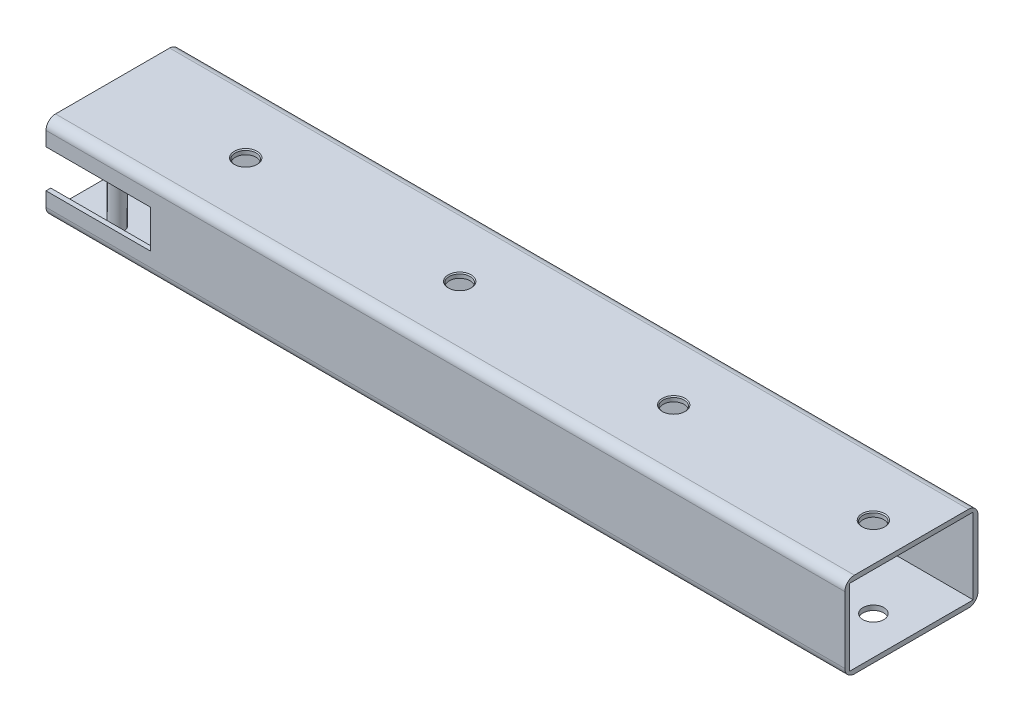
from build123d import *

# Parameters (mm, degrees)
SKETCH1_W                        = 840
SKETCH1_H                        = 140
BOSS_EXTRUDE1_DEPTH              = 90
SKETCH2_W                        = 130
SKETCH2_H                        = 80
CUT_EXTRUDE1_DEPTH               = 848.702778101
FILLET2_R                        = 10
FILLET4_R                        = 10
M24X2_0_TAPPED_HOLE1_D           = 22
M24X2_0_TAPPED_HOLE1_CSINK_D     = 24.05
M24X2_0_TAPPED_HOLE1_CSINK_ANGLE = 90
CUT_EXTRUDE2_REACH               = 453.774
SKETCH7_W                        = 127
SKETCH7_H                        = 40
BOSS_EXTRUDE2_REACH              = 436.195
SKETCH8_R                        = 7.5


with BuildPart() as part:
    # Sketch1 → Boss-Extrude1 (new body)
    with BuildSketch(Plane(origin=(0, 0, 0), x_dir=(1, 0, 0), z_dir=(0, 1, 0))):
        Rectangle(SKETCH1_W, SKETCH1_H)
    extrude(amount=BOSS_EXTRUDE1_DEPTH)

    # Sketch2 → Cut-Extrude1 (cut, through all)
    with BuildSketch(Plane(origin=(420, 0, 0), x_dir=(0, 0, -1), z_dir=(1, 0, 0))):
        with Locations((0, 45)):
            Rectangle(SKETCH2_W, SKETCH2_H)
    extrude(amount=-CUT_EXTRUDE1_DEPTH, mode=Mode.SUBTRACT)

    # Fillet2
    fillet2_edges = [part.edges().sort_by_distance(p)[0] for p in [
        (0, 0, -70),
        (0, 90, -70),
    ]]
    fillet(fillet2_edges, radius=FILLET2_R)

    # Fillet4
    fillet4_edges = [part.edges().sort_by_distance(p)[0] for p in [
        (0, 90, 70),
        (0, 0, 70),
    ]]
    fillet(fillet4_edges, radius=FILLET4_R)

    # M24x2.0 Tapped Hole1 (through all)
    with Locations(Plane(origin=(0, 90, 0), x_dir=(1, 0, 0), z_dir=(0, 1, 0))):
        with Locations((-55, 0), (170, 0), (-280, 0), (380, 0)):
            CounterSinkHole(M24X2_0_TAPPED_HOLE1_D / 2, M24X2_0_TAPPED_HOLE1_CSINK_D / 2, counter_sink_angle=M24X2_0_TAPPED_HOLE1_CSINK_ANGLE)

    # Sketch7 → Cut-Extrude2 (cut, up to next)
    with BuildSketch(Plane.XY.offset(70), mode=Mode.PRIVATE) as cut_extrude2_sk1:
        with Locations((-373.5, 45)):
            Rectangle(SKETCH7_W, SKETCH7_H)
    cut_extrude2_tool1 = extrude(cut_extrude2_sk1.sketch, amount=-CUT_EXTRUDE2_REACH, mode=Mode.PRIVATE) & part.part
    add(cut_extrude2_tool1.solids().sort_by_distance((-373.5, 45, 70))[0], mode=Mode.SUBTRACT)

    # Sketch8 → Boss-Extrude2 (add, up to next)
    with BuildSketch(Plane(origin=(0, 5, 0), x_dir=(1, 0, 0), z_dir=(0, 1, 0)), mode=Mode.PRIVATE) as boss_extrude2_sk1:
        with Locations(Location((-370, -45, 0), (0, 0, 90))):
            Circle(SKETCH8_R)
    boss_extrude2_tool1 = extrude(boss_extrude2_sk1.sketch, amount=BOSS_EXTRUDE2_REACH, mode=Mode.PRIVATE) - part.part
    add(boss_extrude2_tool1.solids().sort_by_distance((-370, 5, 45))[0])


solid = part.part
